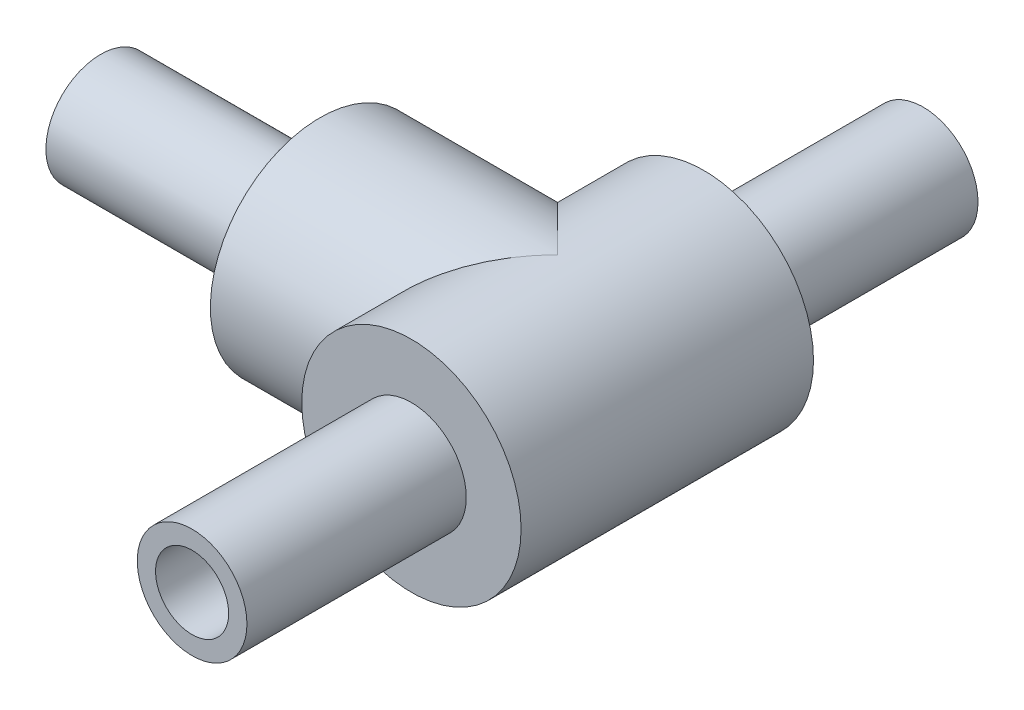
from build123d import *

# Parameters (mm, degrees)
RUN_HUB_START       = -8
SKETCH1_R           = 6
RUN_HUB_DEPTH       = 16
BRANCH_HUB_START    = -13
SKETCH2_R           = 6
BRANCH_HUB_DEPTH    = 13
BARB_FRONT_START    = 8
SKETCH3_R           = 3
BARB_FRONT_DEPTH    = 12
BARB_BACK_START     = -20
SKETCH4_R           = 3
BARB_BACK_DEPTH     = 12
BARB_BRANCH_START   = -25
SKETCH5_R           = 3
BARB_BRANCH_DEPTH   = 12
RUN_BORE_DEPTH      = 33.57299495
RUN_BORE_DEPTH_BACK = 33.57299495
SKETCH6_R           = 2
BRANCH_BORE_START   = -26
SKETCH7_R           = 2
BRANCH_BORE_DEPTH   = 26


with BuildPart() as part:
    # Sketch1 → Run_Hub (new body)
    with BuildSketch(Plane.XY.offset(RUN_HUB_START)):
        Circle(SKETCH1_R)
    extrude(amount=RUN_HUB_DEPTH)

    # Sketch2 → Branch_Hub (add)
    with BuildSketch(Plane(origin=(0, 0, 0), x_dir=(0, 0, -1), z_dir=(1, 0, 0)).offset(BRANCH_HUB_START)):
        with Locations(Location((0, 0, 0), (0, 0, 270))):
            Circle(SKETCH2_R)
    extrude(amount=BRANCH_HUB_DEPTH)

    # Sketch3 → Barb_Front (add)
    with BuildSketch(Plane.XY.offset(BARB_FRONT_START)):
        Circle(SKETCH3_R)
    extrude(amount=BARB_FRONT_DEPTH)

    # Sketch4 → Barb_Back (add)
    with BuildSketch(Plane.XY.offset(BARB_BACK_START)):
        Circle(SKETCH4_R)
    extrude(amount=BARB_BACK_DEPTH)

    # Sketch5 → Barb_Branch (add)
    with BuildSketch(Plane(origin=(0, 0, 0), x_dir=(0, 0, -1), z_dir=(1, 0, 0)).offset(BARB_BRANCH_START)):
        Circle(SKETCH5_R)
    extrude(amount=BARB_BRANCH_DEPTH)

    # Sketch6 → Run_Bore (cut, two sides: drawn at the far end of the back side and taken through both)
    with BuildSketch(Plane.XY.offset(-RUN_BORE_DEPTH_BACK)):
        Circle(SKETCH6_R)
    extrude(amount=RUN_BORE_DEPTH + RUN_BORE_DEPTH_BACK, mode=Mode.SUBTRACT)

    # Sketch7 → Branch_Bore (cut)
    with BuildSketch(Plane(origin=(0, 0, 0), x_dir=(0, 0, -1), z_dir=(1, 0, 0)).offset(BRANCH_BORE_START)):
        with Locations(Location((0, 0, 0), (0, 0, 90))):
            Circle(SKETCH7_R)
    extrude(amount=BRANCH_BORE_DEPTH, mode=Mode.SUBTRACT)


solid = part.part
